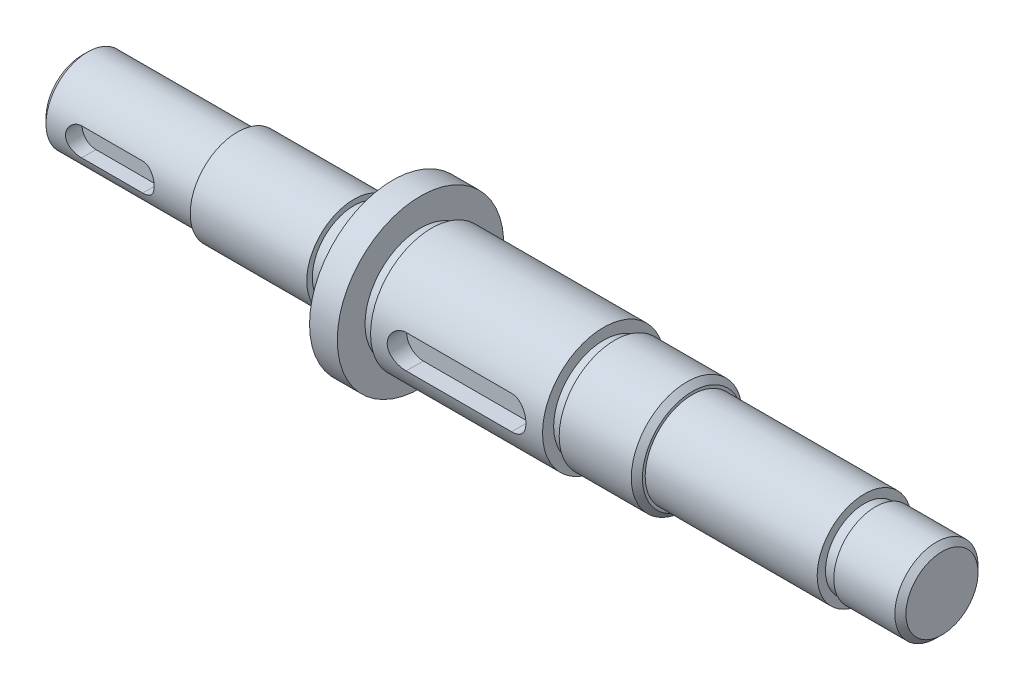
from build123d import *

# Parameters (mm, degrees)
CUT_EXTRUDE_1_DEPTH = 3
CUT_EXTRUDE_2_DEPTH = 3.5
CHAMFER_1_SIZE      = 1


with BuildPart() as part:
    # 草图1 → 旋转1 (revolve)
    with BuildSketch(Plane.XY, mode=Mode.PRIVATE) as revolve_1_sk:
        Polygon((0, 0), (0, 7.5), (28, 7.5), (28, 8.5), (49, 8.5), (49, 7.5), (51, 7.5), (51, 5), (56, 5), (56, 15), (61, 15), (61, 10), (63, 10), (63, 11), (94, 11), (94, 9), (96, 9), (96, 10), (110, 10), (110, 8.5), (141, 8.5), (141, 7), (143, 7), (143, 7.5), (155, 7.5), (155, 0), align=None)
    revolve(revolve_1_sk.sketch.rotate(Axis((0, 0, 0), (1, 0, 0)), 90), axis=Axis((0, 0, 0), (1, 0, 0)))

    # 草图2 → 切除-拉伸1 (cut)
    with BuildSketch(Plane.XY.offset(7.5)):
        with BuildLine():
            Line((18, -2.5), (7, -2.5))
            ThreePointArc((7, -2.5), (4.5, 0), (7, 2.5))
            Line((7, 2.5), (18, 2.5))
            ThreePointArc((18, 2.5), (20.5, 0), (18, -2.5))
        make_face()
    extrude(amount=-CUT_EXTRUDE_1_DEPTH, mode=Mode.SUBTRACT)

    # 草图3 → 切除-拉伸2 (cut)
    with BuildSketch(Plane(origin=(0, 0, 11), x_dir=(-1, 0, 0), z_dir=(0, 0, 1))):
        with BuildLine():
            Line((-88, 3), (-69, 3))
            ThreePointArc((-69, 3), (-66, 0), (-69, -3))
            Line((-69, -3), (-88, -3))
            ThreePointArc((-88, -3), (-91, 0), (-88, 3))
        make_face()
    extrude(amount=-CUT_EXTRUDE_2_DEPTH, mode=Mode.SUBTRACT)

    # 倒角1
    chamfer_1_edges = [part.edges().sort_by_distance(p)[0] for p in [
        (155, 0, -7.5),
        (110, 0, -10),
        (0, 0, -7.5),
    ]]
    chamfer(chamfer_1_edges, length=CHAMFER_1_SIZE)


solid = part.part
